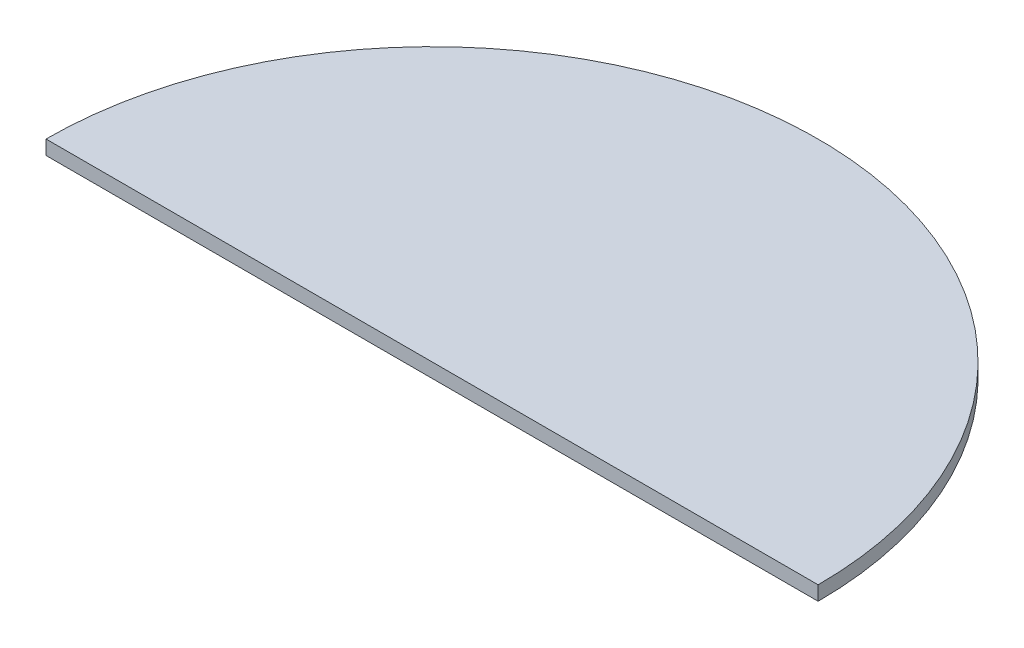
from build123d import *

# Parameters (mm, degrees)
BOSS_EXTRUDE1_DEPTH = 0.5


with BuildPart() as part:
    # Sketch2 → Boss-Extrude1 (new body)
    with BuildSketch(Plane(origin=(0, 0, 0), x_dir=(1, 0, 0), z_dir=(0, 1, 0))):
        with BuildLine():
            Line((-13.5, 0), (13.5, 0))
            ThreePointArc((13.5, 0), (0, 13.5), (-13.5, 0))
        make_face()
    extrude(amount=BOSS_EXTRUDE1_DEPTH)


solid = part.part
